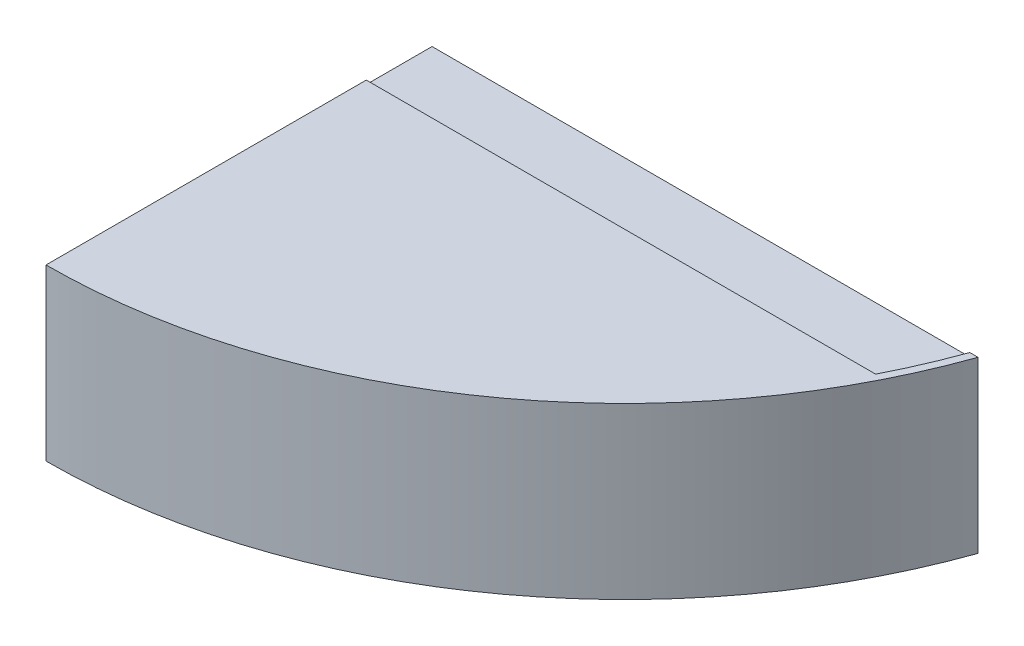
from build123d import *

# Parameters (mm, degrees)
BOSS_EXTRUDE1_DEPTH = 44
SHELL1_T            = -2
CUT_EXTRUDE1_START  = -1
CUT_EXTRUDE1_DEPTH  = 1


with BuildPart() as part:
    # Sketch1 → Boss-Extrude1 (new body)
    with BuildSketch(Plane(origin=(0, 0, 0), x_dir=(1, 0, 0), z_dir=(0, 1, 0))):
        with BuildLine():
            Line((0, -150), (0, -50))
            Line((0, -50), (141.421356237, -50))
            ThreePointArc((141.421356237, -50), (86.602540378, -122.474487139), (0, -150))
        make_face()
    extrude(amount=BOSS_EXTRUDE1_DEPTH)

    # Shell1
    shell1_openings = [part.faces().sort_by_distance(p)[0] for p in [
        (56.564232989, 0, 91.421606215),
        (0, 22, 100),
        (70.710678119, 22, 50),
    ]]
    offset(amount=SHELL1_T, openings=shell1_openings, kind=Kind.INTERSECTION)

    # Sketch2 → Cut-Extrude1 (cut)
    with BuildSketch(Plane(origin=(0, 44, 0), x_dir=(1, 0, 0), z_dir=(0, 1, 0)).offset(CUT_EXTRUDE1_START)):
        with BuildLine():
            Line((0, -67.040946117), (131.94510807, -67.040946117))
            ThreePointArc((131.94510807, -67.040946117), (135.889061706, -58.635850029), (139.298241195, -50))
            Line((139.298241195, -50), (0, -50))
            Line((0, -50), (0, -67.040946117))
        make_face()
    extrude(amount=CUT_EXTRUDE1_DEPTH, mode=Mode.SUBTRACT)


solid = part.part
